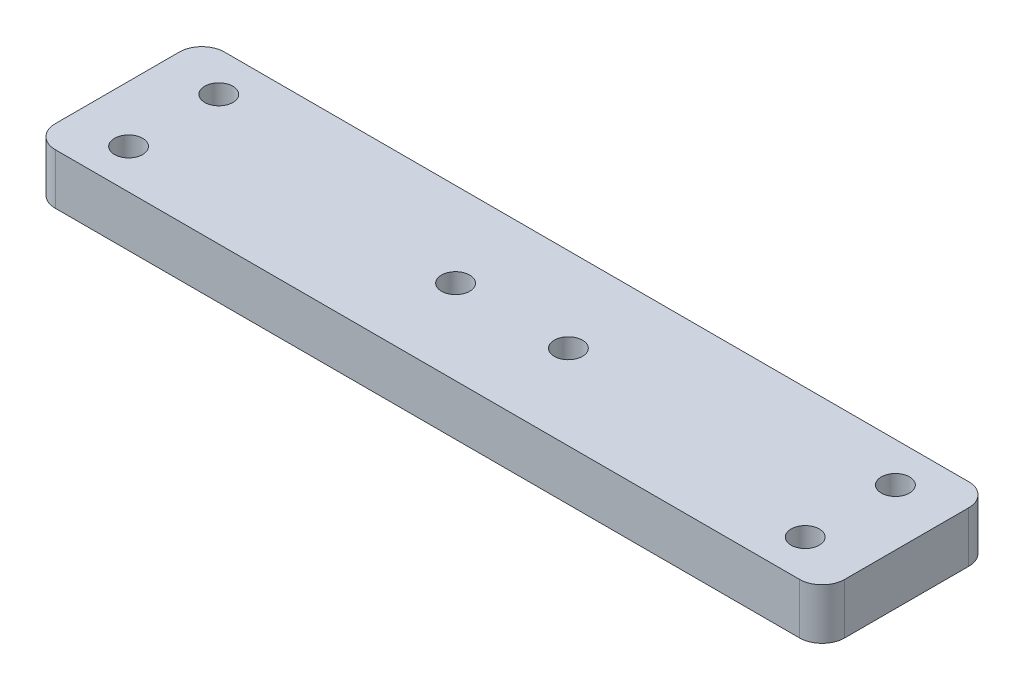
from build123d import *

# Parameters (mm, degrees)
SKETCH_1_R      = 1.25
EXTRUDE_1_DEPTH = 4.5


with BuildPart() as part:
    # 草图1 → 凸台-拉伸1 (new body)
    with BuildSketch(Plane(origin=(0, 0, 0), x_dir=(1, 0, 0), z_dir=(0, 1, 0))):
        with BuildLine():
            Line((-33, 7.5), (33, 7.5))
            ThreePointArc((33, 7.5), (34.414213562, 6.914213562), (35, 5.5))
            Line((35, 5.5), (35, -5.5))
            ThreePointArc((35, -5.5), (34.414213562, -6.914213562), (33, -7.5))
            Line((33, -7.5), (-33, -7.5))
            ThreePointArc((-33, -7.5), (-34.414213562, -6.914213562), (-35, -5.5))
            Line((-35, -5.5), (-35, 5.5))
            ThreePointArc((-35, 5.5), (-34.414213562, 6.914213562), (-33, 7.5))
        make_face()
        with Locations(Location((-5, 0, 0), (0, 0, 270))):
            Circle(SKETCH_1_R, mode=Mode.SUBTRACT)
        with Locations(Location((5, 0, 0), (0, 0, 270))):
            Circle(SKETCH_1_R, mode=Mode.SUBTRACT)
        with Locations(Location((-30, 4, 0), (0, 0, 270))):
            Circle(SKETCH_1_R, mode=Mode.SUBTRACT)
        with Locations(Location((-30, -4, 0), (0, 0, 270))):
            Circle(SKETCH_1_R, mode=Mode.SUBTRACT)
        with Locations(Location((30, -4, 0), (0, 0, 270))):
            Circle(SKETCH_1_R, mode=Mode.SUBTRACT)
        with Locations(Location((30, 4, 0), (0, 0, 270))):
            Circle(SKETCH_1_R, mode=Mode.SUBTRACT)
    extrude(amount=EXTRUDE_1_DEPTH)


solid = part.part
